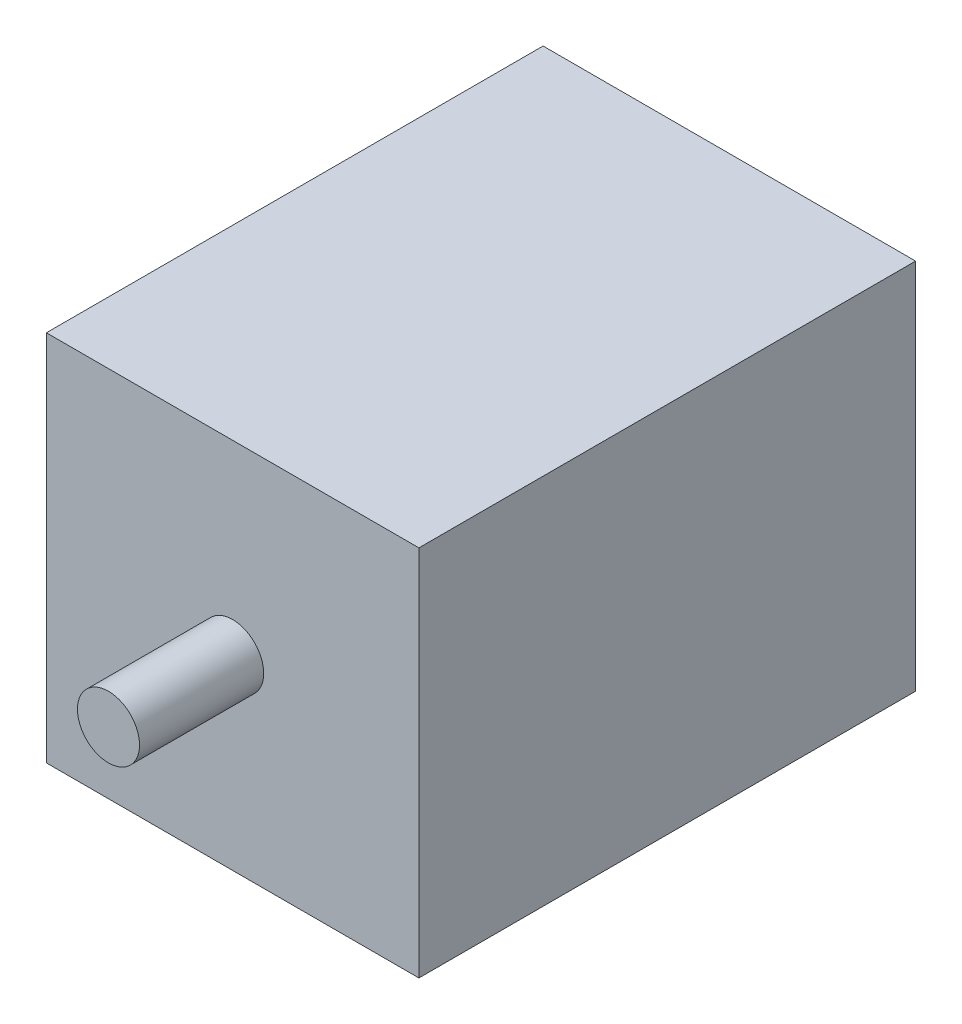
from build123d import *

# Parameters (mm, degrees)
SKETCH1_W           = 38.1
SKETCH1_H           = 38.1
BOSS_EXTRUDE1_DEPTH = 25.4
SKETCH2_R           = 3.175
BOSS_EXTRUDE2_DEPTH = 12.7


with BuildPart() as part:
    # Sketch1 → Boss-Extrude1 (new, symmetric)
    with BuildSketch(Plane.XY):
        Rectangle(SKETCH1_W, SKETCH1_H)
    extrude(amount=BOSS_EXTRUDE1_DEPTH, both=True)

    # Sketch2 → Boss-Extrude2 (add)
    with BuildSketch(Plane.XY.offset(25.4)):
        with Locations(Location((0, 0, 0), (0, 0, 180))):
            Circle(SKETCH2_R)
    extrude(amount=BOSS_EXTRUDE2_DEPTH)


solid = part.part
